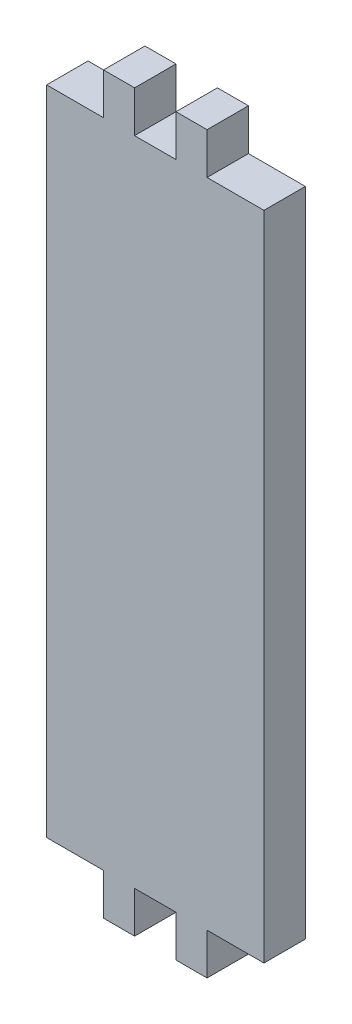
from build123d import *

# Parameters (mm, degrees)
SKETCH1_W           = 26.66
SKETCH1_H           = 79.98
BOSS_EXTRUDE1_DEPTH = 5.08
SKETCH2_W           = 3.81
SKETCH2_H           = 5.08
BOSS_EXTRUDE2_DEPTH = 5.08


with BuildPart() as part:
    # Sketch1 → Boss-Extrude1 (new body)
    with BuildSketch(Plane.XY):
        with Locations((3.269622642, -11.770641509)):
            Rectangle(SKETCH1_W, SKETCH1_H)
    extrude(amount=BOSS_EXTRUDE1_DEPTH)

    # Sketch2 → Boss-Extrude2 (add)
    with BuildSketch(Plane.XY.offset(5.08)):
        with Locations((-1.175377358, -54.300641509)):
            Rectangle(SKETCH2_W, SKETCH2_H)
        with Locations((7.714622642, 30.759358491)):
            Rectangle(SKETCH2_W, SKETCH2_H)
        with Locations((-1.175377358, 30.759358491)):
            Rectangle(SKETCH2_W, SKETCH2_H)
        with Locations((7.714622642, -54.300641509)):
            Rectangle(SKETCH2_W, SKETCH2_H)
    extrude(amount=-BOSS_EXTRUDE2_DEPTH)


solid = part.part
